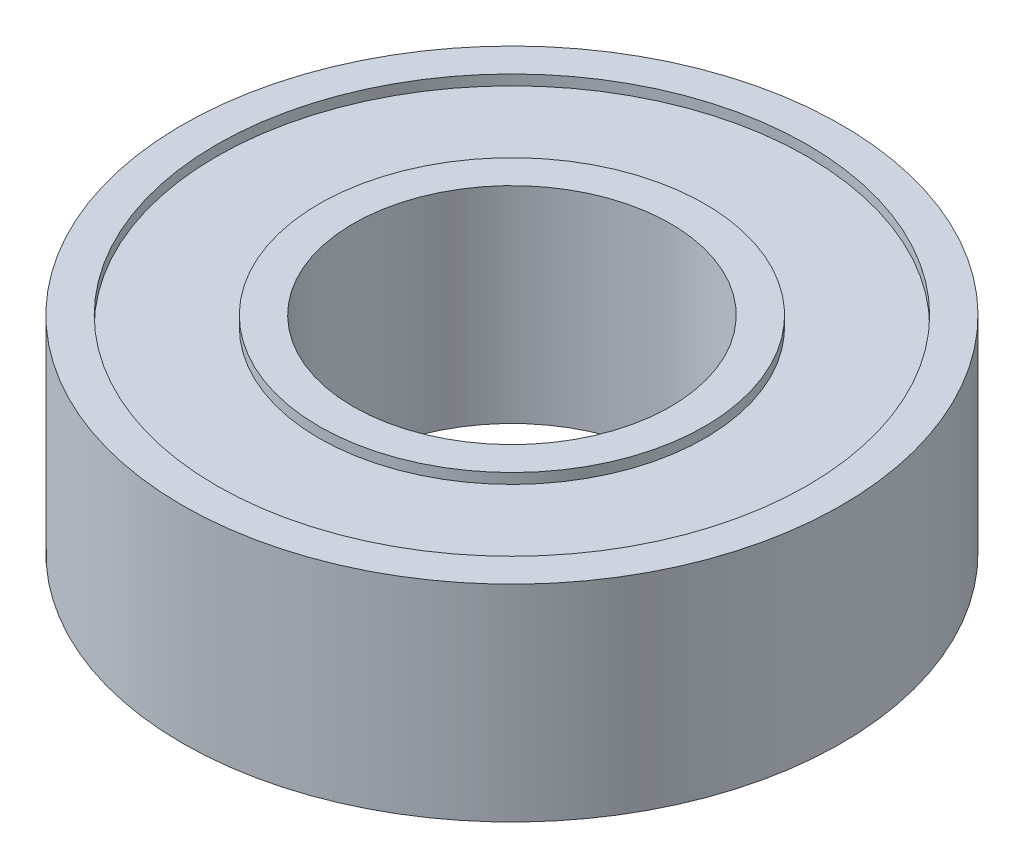
from build123d import *

# Parameters (mm, degrees)
SKETCH_1_R          = 8
SKETCH_1_R_2        = 3.85
EXTRUDE_1_DEPTH     = 2.5
SKETCH_2_R          = 7.17
SKETCH_2_R_2        = 4.68
CUT_EXTRUDE_1_DEPTH = 0.25


with BuildPart() as part:
    # Эскиз1 → Бобышка-Вытянуть1 (new, symmetric)
    with BuildSketch(Plane(origin=(0, 0, 0), x_dir=(1, 0, 0), z_dir=(0, 1, 0))):
        with Locations(Location((0, 0, 0), (0, 0, 270))):
            Circle(SKETCH_1_R)
        with Locations(Location((0, 0, 0), (0, 0, 270))):
            Circle(SKETCH_1_R_2, mode=Mode.SUBTRACT)
    extrude(amount=EXTRUDE_1_DEPTH, both=True)

    # Эскиз2 → Вырез-Вытянуть1 (cut)
    with BuildSketch(Plane(origin=(0, 2.5, 0), x_dir=(1, 0, 0), z_dir=(0, 1, 0))):
        with Locations(Location((0, 0, 0), (0, 0, 270))):
            Circle(SKETCH_2_R)
        with Locations(Location((0, 0, 0), (0, 0, 270))):
            Circle(SKETCH_2_R_2, mode=Mode.SUBTRACT)
    cut_extrude_1 = extrude(amount=-CUT_EXTRUDE_1_DEPTH, mode=Mode.SUBTRACT)

    # Зеркальное отражение1: Вырез-Вытянуть1 across plane
    add(cut_extrude_1.mirror(Plane.ZX), mode=Mode.SUBTRACT)


solid = part.part
